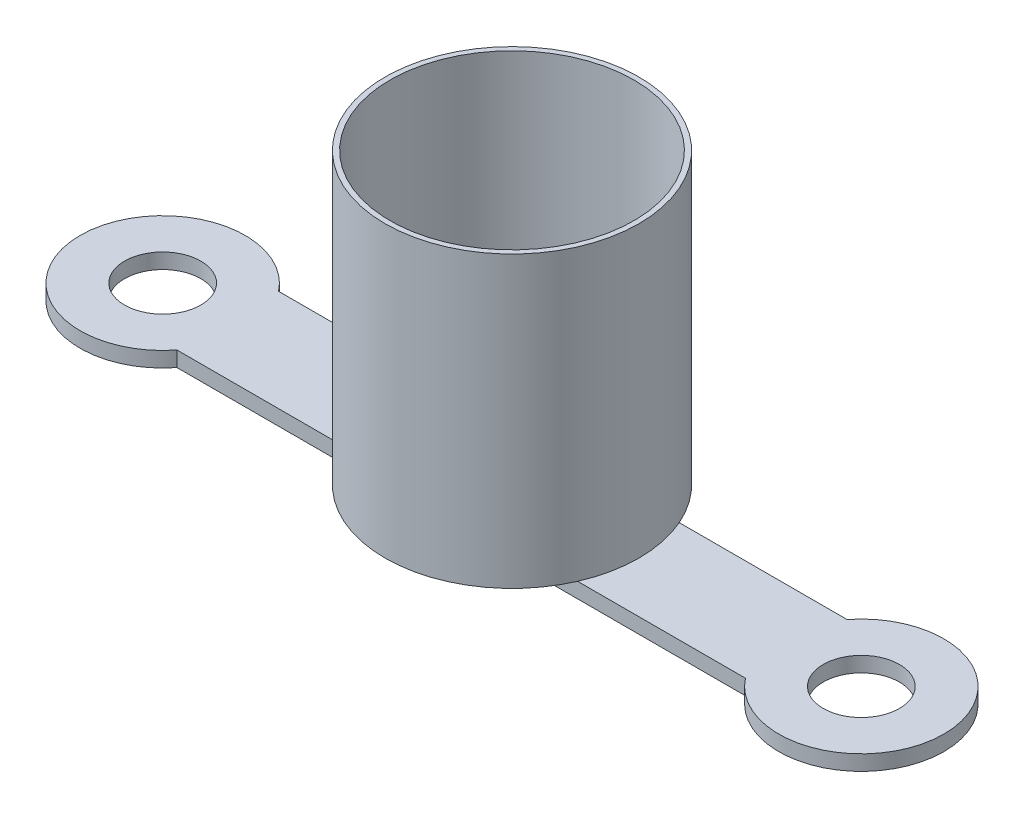
from build123d import *

# Parameters (mm, degrees)
SCHIZZO1_R                   = 1.5
ESTRUSIONE_ESTRUSIONE1_DEPTH = 0.6
SCHIZZO2_R                   = 5
ESTRUSIONE_ESTRUSIONE2_DEPTH = 0.6
SCHIZZO3_R                   = 5
SCHIZZO3_R_2                 = 4.8
ESTRUSIONE_ESTRUSIONE3_DEPTH = 10.8


with BuildPart() as part:
    # Schizzo1 → Estrusione-Estrusione1 (new body)
    # profile 1 of 5: a face of its own
    with BuildSketch(Plane(origin=(0, 0, 0), x_dir=(1, 0, 0), z_dir=(0, 1, 0))):
        with BuildLine():
            ThreePointArc((2.561737691, 2), (-3.25, 0), (2.561737691, -2))
            Line((2.561737691, -2), (2.561737691, 2))
        make_face()
        with Locations(Location((0, 0, 0), (0, 0, 270))):
            Circle(SCHIZZO1_R, mode=Mode.SUBTRACT)
    # profile 2 of 5: a face of its own
    with BuildSketch(Plane(origin=(0, 0, 0), x_dir=(1, 0, 0), z_dir=(0, 1, 0))):
        with BuildLine():
            ThreePointArc((3.25, 0), (3.073121174, -1.057556737), (2.561737691, -2))
            Line((2.561737691, -2), (24.938262309, -2))
            ThreePointArc((24.938262309, -2), (24.25, 0), (24.938262309, 2))
            Line((24.938262309, 2), (2.561737691, 2))
            ThreePointArc((2.561737691, 2), (3.073121174, 1.057556737), (3.25, 0))
        make_face()
    # profile 3 of 5: a face of its own
    with BuildSketch(Plane(origin=(0, 0, 0), x_dir=(1, 0, 0), z_dir=(0, 1, 0))):
        with BuildLine():
            Line((2.561737691, 2), (2.561737691, -2))
            ThreePointArc((2.561737691, -2), (3.073121174, -1.057556737), (3.25, 0))
            ThreePointArc((3.25, 0), (3.073121174, 1.057556737), (2.561737691, 2))
        make_face()
    # profile 4 of 5: a face of its own
    with BuildSketch(Plane(origin=(0, 0, 0), x_dir=(1, 0, 0), z_dir=(0, 1, 0))):
        with BuildLine():
            Line((24.938262309, 2), (24.938262309, -2))
            ThreePointArc((24.938262309, -2), (28.557556737, -3.073121174), (30.75, 0))
            ThreePointArc((30.75, 0), (28.557556737, 3.073121174), (24.938262309, 2))
        make_face()
        with Locations(Location((27.5, 0, 0), (0, 0, 270))):
            Circle(SCHIZZO1_R, mode=Mode.SUBTRACT)
    # profile 5 of 5: a face of its own
    with BuildSketch(Plane(origin=(0, 0, 0), x_dir=(1, 0, 0), z_dir=(0, 1, 0))):
        with BuildLine():
            ThreePointArc((24.938262309, 2), (24.25, 0), (24.938262309, -2))
            Line((24.938262309, -2), (24.938262309, 2))
        make_face()
    extrude(amount=ESTRUSIONE_ESTRUSIONE1_DEPTH)

    # Schizzo2 → Estrusione-Estrusione2 (add)
    with BuildSketch(Plane(origin=(0, 0.6, 0), x_dir=(1, 0, 0), z_dir=(0, 1, 0))):
        with Locations(Location((13.75, 0, 0), (0, 0, 23.578178478))):
            Circle(SCHIZZO2_R)
    extrude(amount=ESTRUSIONE_ESTRUSIONE2_DEPTH)

    # Schizzo3 → Estrusione-Estrusione3 (add)
    with BuildSketch(Plane(origin=(0, 1.2, 0), x_dir=(1, 0, 0), z_dir=(0, 1, 0))):
        with Locations(Location((13.75, 0, 0), (0, 0, 23.578178478))):
            Circle(SCHIZZO3_R)
        with Locations(Location((13.75, 0, 0), (0, 0, 90))):
            Circle(SCHIZZO3_R_2, mode=Mode.SUBTRACT)
    extrude(amount=ESTRUSIONE_ESTRUSIONE3_DEPTH)


solid = part.part
